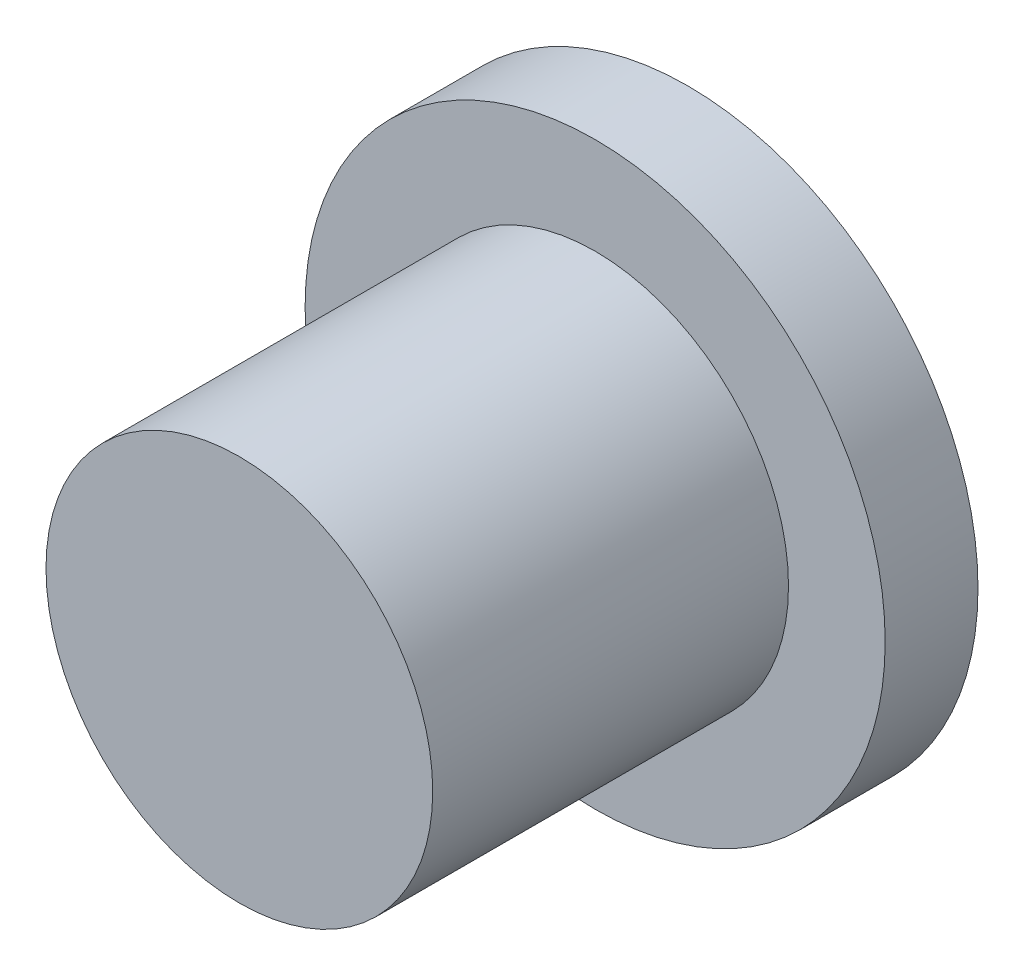
from build123d import *

# Parameters (mm, degrees)
SKETCH1_R              = 2.5
M6_ADJUSTER_CORE_DEPTH = 5.8
SKETCH2_R              = 3.75
JAM_NUT_ENVELOPE_DEPTH = 1.2


with BuildPart() as part:
    # Sketch1 → M6 adjuster core (new body)
    with BuildSketch(Plane.XY):
        Circle(SKETCH1_R)
    extrude(amount=M6_ADJUSTER_CORE_DEPTH)

    # Sketch2 → Jam nut envelope (add)
    with BuildSketch(Plane.XY):
        Circle(SKETCH2_R)
    extrude(amount=JAM_NUT_ENVELOPE_DEPTH)


solid = part.part
